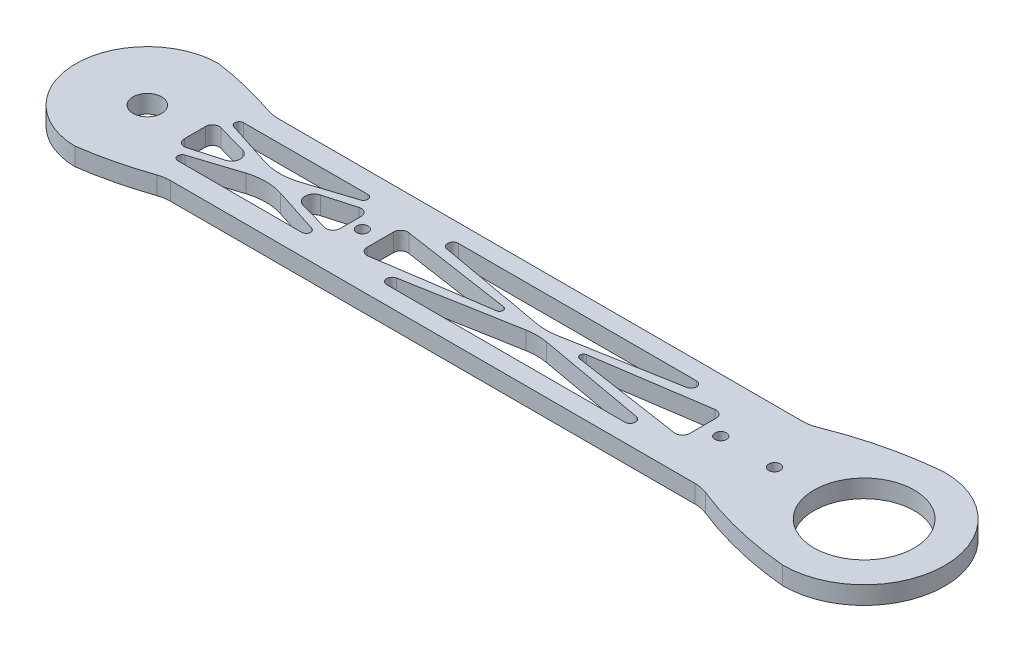
from build123d import *

# Parameters (mm, degrees)
EXTRUDE_1_DEPTH     = 5
SKETCH_2_R          = 4
CUT_EXTRUDE_1_DEPTH = 6
SKETCH_3_R          = 14
CUT_EXTRUDE_2_DEPTH = 10
CUT_EXTRUDE_4_DEPTH = 224.690634583
FILLET_1_R          = 10
SKETCH_11_R         = 1.6
CUT_EXTRUDE_5_DEPTH = 224.690634583
CUT_EXTRUDE_6_DEPTH = 10


with BuildPart() as part:
    # 草图1 → 凸台-拉伸1 (new body)
    with BuildSketch(Plane(origin=(0, 0, 0), x_dir=(1, 0, 0), z_dir=(0, 1, 0))):
        with BuildLine():
            Line((-0.25, 19.998437439), (199.71875, 22.498242119))
            ThreePointArc((199.71875, 22.498242119), (222.5, 0), (199.71875, -22.498242119))
            Line((199.71875, -22.498242119), (-0.25, -19.998437439))
            ThreePointArc((-0.25, -19.998437439), (-20, 0), (-0.25, 19.998437439))
        make_face()
    extrude(amount=EXTRUDE_1_DEPTH)

    # 草图2 → 切除-拉伸1 (cut)
    with BuildSketch(Plane(origin=(0, 5, 0), x_dir=(1, 0, 0), z_dir=(0, 1, 0))):
        with Locations(Location((0, 0, 0), (0, 0, 270))):
            Circle(SKETCH_2_R)
    extrude(amount=-CUT_EXTRUDE_1_DEPTH, mode=Mode.SUBTRACT)

    # 草图3 → 切除-拉伸2 (cut)
    with BuildSketch(Plane(origin=(0, 5, 0), x_dir=(1, 0, 0), z_dir=(0, 1, 0))):
        with Locations(Location((200, 0, 0), (0, 0, 270))):
            Circle(SKETCH_3_R)
    extrude(amount=-CUT_EXTRUDE_2_DEPTH, mode=Mode.SUBTRACT)

    # 草图10 → 切除-拉伸4 (cut, through all)
    with BuildSketch(Plane(origin=(0, 5, 0), x_dir=(1, 0, 0), z_dir=(0, 1, 0))):
        with BuildLine():
            Line((19.75, 15), (169.71875, 15))
            ThreePointArc((169.71875, 15), (184.427162899, 19.915742901), (199.71875, 22.498242119))
            Line((199.71875, 22.498242119), (-0.25, 19.998437439))
            ThreePointArc((-0.25, 19.998437439), (9.879148371, 18.015973695), (19.75, 15))
        make_face()
        with BuildLine():
            Line((19.75, -15), (169.71875, -15))
            ThreePointArc((169.71875, -15), (184.427162899, -19.915742901), (199.71875, -22.498242119))
            Line((199.71875, -22.498242119), (-0.25, -19.998437439))
            ThreePointArc((-0.25, -19.998437439), (9.879148371, -18.015973695), (19.75, -15))
        make_face()
    extrude(amount=-CUT_EXTRUDE_4_DEPTH, mode=Mode.SUBTRACT)

    # 圆角1
    fillet_1_edges = [part.edges().sort_by_distance(p)[0] for p in [
        (169.71875, 2.5, 15),
        (19.75, 2.5, 15),
        (19.75, 2.5, -15),
        (169.71875, 2.5, -15),
    ]]
    fillet(fillet_1_edges, radius=FILLET_1_R)

    # 草图11 → 切除-拉伸5 (cut, through all)
    with BuildSketch(Plane(origin=(0, 5, 0), x_dir=(1, 0, 0), z_dir=(0, 1, 0))):
        with Locations(Location((160, 0, 0), (0, 0, 270))):
            Circle(SKETCH_11_R)
        with Locations(Location((60, 0, 0), (0, 0, 270))):
            Circle(SKETCH_11_R)
        with Locations(Location((175, 0, 0), (0, 0, 270))):
            Circle(SKETCH_11_R)
        with BuildLine():
            Line((76.800590531, 10), (143.199409469, 10))
            ThreePointArc((143.199409469, 10), (144.693466443, 8.633393255), (143.465138967, 7.023725014))
            Line((143.465138967, 7.023725014), (112.834447973, 1.510200635))
            ThreePointArc((112.834447973, 1.510200635), (110, 1.257133819), (107.165552027, 1.510200635))
            Line((107.165552027, 1.510200635), (76.534861033, 7.023725014))
            ThreePointArc((76.534861033, 7.023725014), (75.306533557, 8.633393255), (76.800590531, 10))
        make_face()
        with BuildLine():
            Line((65, 3.677625158), (65, -3.677625158))
            ThreePointArc((65, -3.677625158), (65.694887325, -5.193105579), (67.296680906, -5.655497864))
            Line((67.296680906, -5.655497864), (98.407090981, -0.988936353))
            ThreePointArc((98.407090981, -0.988936353), (99.258750528, 0), (98.407090981, 0.988936353))
            Line((98.407090981, 0.988936353), (67.296680906, 5.655497864))
            ThreePointArc((67.296680906, 5.655497864), (65.694887325, 5.193105579), (65, 3.677625158))
        make_face()
        with BuildLine():
            Line((155, 3.677625158), (155, -3.677625158))
            ThreePointArc((155, -3.677625158), (154.305112675, -5.193105579), (152.703319094, -5.655497864))
            Line((152.703319094, -5.655497864), (121.592909019, -0.988936353))
            ThreePointArc((121.592909019, -0.988936353), (120.741249472, 0), (121.592909019, 0.988936353))
            Line((121.592909019, 0.988936353), (152.703319094, 5.655497864))
            ThreePointArc((152.703319094, 5.655497864), (154.305112675, 5.193105579), (155, 3.677625158))
        make_face()
        with BuildLine():
            Line((76.534861033, -7.023725014), (107.165552027, -1.510200635))
            ThreePointArc((107.165552027, -1.510200635), (110, -1.257133819), (112.834447973, -1.510200635))
            Line((112.834447973, -1.510200635), (143.465138967, -7.023725014))
            ThreePointArc((143.465138967, -7.023725014), (144.693466443, -8.633393255), (143.199409469, -10))
            Line((143.199409469, -10), (76.800590531, -10))
            ThreePointArc((76.800590531, -10), (75.306533557, -8.633393255), (76.534861033, -7.023725014))
        make_face()
    extrude(amount=-CUT_EXTRUDE_5_DEPTH, mode=Mode.SUBTRACT)

    # 草图12 → 切除-拉伸6 (cut)
    with BuildSketch(Plane(origin=(0, 5, 0), x_dir=(1, 0, 0), z_dir=(0, 1, 0))):
        with BuildLine():
            Line((17.686639759, 9.190462064), (52.313360241, 9.190462064))
            ThreePointArc((52.313360241, 9.190462064), (53.510878101, 8.166743105), (52.685874964, 6.82457346))
            Line((52.685874964, 6.82457346), (39.829631092, 2.67316319))
            ThreePointArc((39.829631092, 2.67316319), (35, 1.91272642), (30.170368908, 2.67316319))
            Line((30.170368908, 2.67316319), (17.314125036, 6.82457346))
            ThreePointArc((17.314125036, 6.82457346), (16.489121899, 8.166743105), (17.686639759, 9.190462064))
        make_face()
        with BuildLine():
            Line((13.279055715, 2.967439032), (13.279055715, -2.967439032))
            ThreePointArc((13.279055715, -2.967439032), (14.040342171, -4.497828215), (15.720146666, -4.813905705))
            Line((15.720146666, -4.813905705), (24.173861919, -2.423097202))
            ThreePointArc((24.173861919, -2.423097202), (26.006717933, 0), (24.173861919, 2.423097202))
            Line((24.173861919, 2.423097202), (15.720146666, 4.813905705))
            ThreePointArc((15.720146666, 4.813905705), (14.040342171, 4.497828215), (13.279055715, 2.967439032))
        make_face()
        with BuildLine():
            Line((56.720944285, 2.967439032), (56.720944285, -2.967439032))
            ThreePointArc((56.720944285, -2.967439032), (55.959657829, -4.497828215), (54.279853334, -4.813905705))
            Line((54.279853334, -4.813905705), (45.826138081, -2.423097202))
            ThreePointArc((45.826138081, -2.423097202), (43.993282067, 0), (45.826138081, 2.423097202))
            Line((45.826138081, 2.423097202), (54.279853334, 4.813905705))
            ThreePointArc((54.279853334, 4.813905705), (55.959657829, 4.497828215), (56.720944285, 2.967439032))
        make_face()
        with BuildLine():
            Line((17.314125036, -6.82457346), (30.170368908, -2.67316319))
            ThreePointArc((30.170368908, -2.67316319), (35, -1.91272642), (39.829631092, -2.67316319))
            Line((39.829631092, -2.67316319), (52.685874964, -6.82457346))
            ThreePointArc((52.685874964, -6.82457346), (53.510878101, -8.166743105), (52.313360241, -9.190462064))
            Line((52.313360241, -9.190462064), (17.686639759, -9.190462064))
            ThreePointArc((17.686639759, -9.190462064), (16.489121899, -8.166743105), (17.314125036, -6.82457346))
        make_face()
    extrude(amount=-CUT_EXTRUDE_6_DEPTH, mode=Mode.SUBTRACT)


solid = part.part
